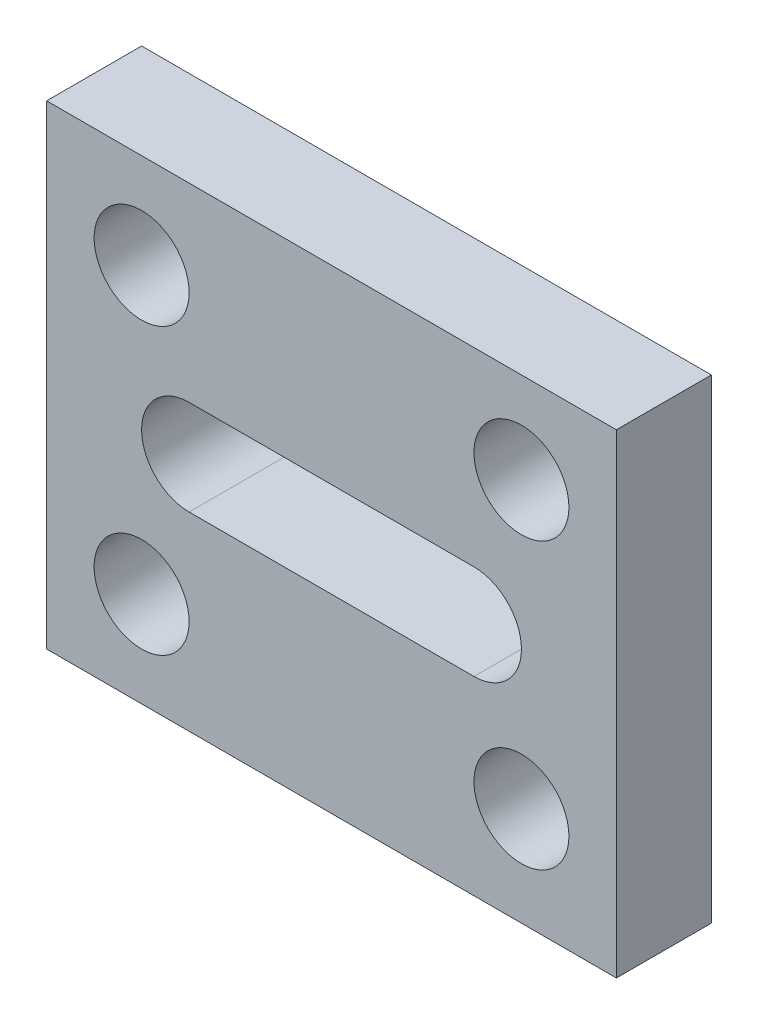
from build123d import *

# Parameters (mm, degrees)
SKETCH1_W           = 120
SKETCH1_H           = 100
SKETCH1_R           = 10
BOSS_EXTRUDE1_DEPTH = 20


with BuildPart() as part:
    # Sketch1 → Boss-Extrude1 (new body)
    with BuildSketch(Plane.XY):
        Rectangle(SKETCH1_W, SKETCH1_H)
        with Locations((-40, -30)):
            Circle(SKETCH1_R, mode=Mode.SUBTRACT)
        with Locations((-40, 30)):
            Circle(SKETCH1_R, mode=Mode.SUBTRACT)
        with Locations((40, 30.850281708)):
            Circle(SKETCH1_R, mode=Mode.SUBTRACT)
        with Locations((40, -29.149718292)):
            Circle(SKETCH1_R, mode=Mode.SUBTRACT)
        with BuildLine():
            Line((30, -10), (-30, -10))
            ThreePointArc((-30, -10), (-40, 0), (-30, 10))
            Line((-30, 10), (30, 10))
            ThreePointArc((30, 10), (40, 0), (30, -10))
        make_face(mode=Mode.SUBTRACT)
    extrude(amount=BOSS_EXTRUDE1_DEPTH)


solid = part.part
